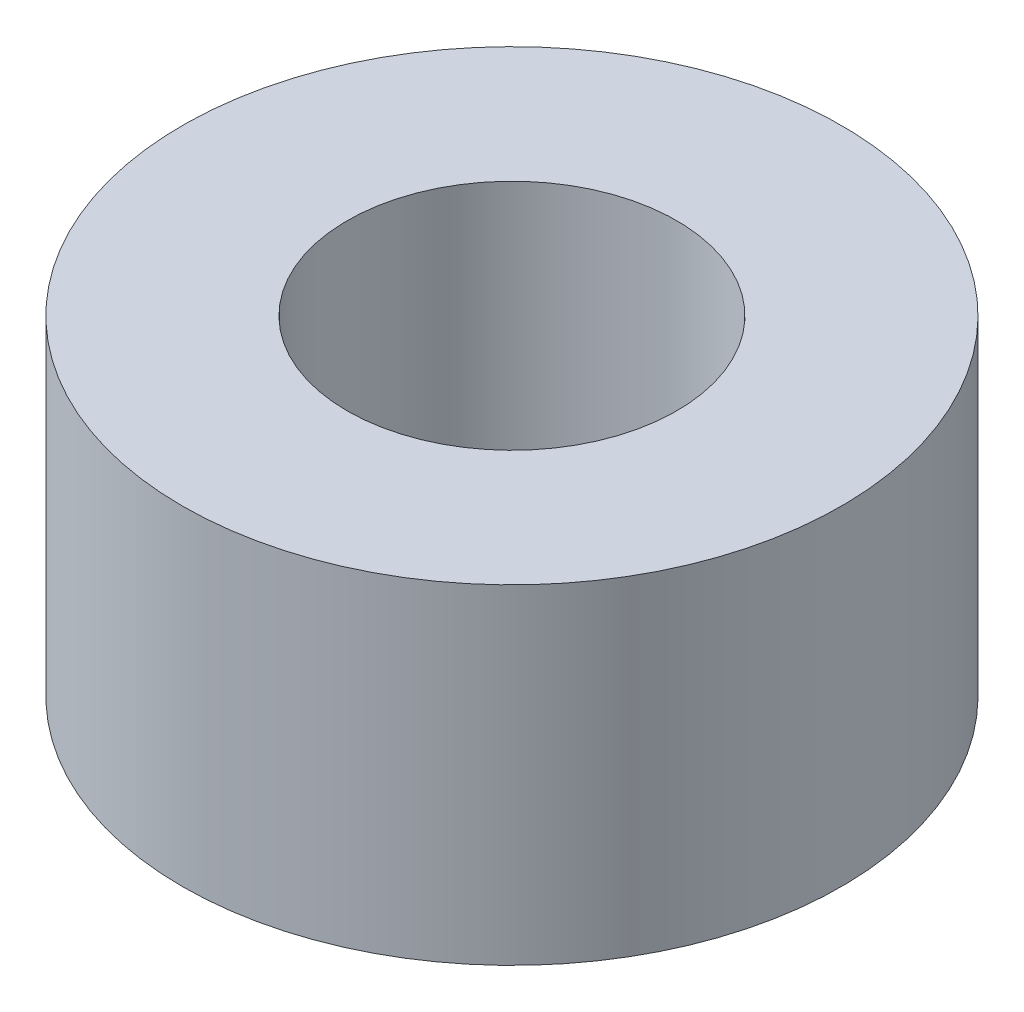
from build123d import *

# Parameters (mm, degrees)
SKETCH1_R           = 40
SKETCH1_R_2         = 20
BOSS_EXTRUDE1_DEPTH = 40


with BuildPart() as part:
    # Sketch1 → Boss-Extrude1 (new body)
    with BuildSketch(Plane(origin=(0, 0, 0), x_dir=(1, 0, 0), z_dir=(0, 1, 0))):
        with Locations(Location((0, 0, 0), (0, 0, 270))):
            Circle(SKETCH1_R)
        with Locations(Location((0, 0, 0), (0, 0, 270))):
            Circle(SKETCH1_R_2, mode=Mode.SUBTRACT)
    extrude(amount=BOSS_EXTRUDE1_DEPTH)


solid = part.part
